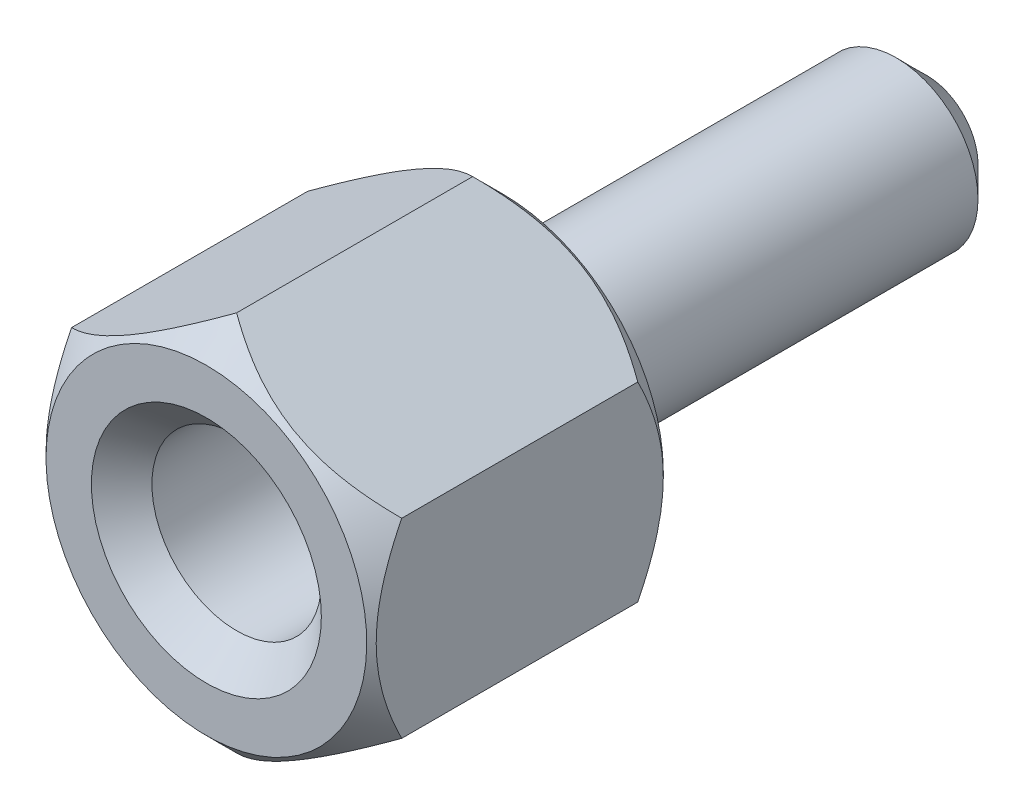
from build123d import *

# Parameters (mm, degrees)
RESSALTO_EXTRUS_O1_DEPTH = 4.9
ESBO_O10_R               = 1.35
RESSALTO_EXTRUS_O2_DEPTH = 7
ESBO_O11_R               = 1.4
CORTE_EXTRUS_O1_DEPTH    = 3.5
CHANFRO1_SIZE            = 0.5
CHANFRO2_SIZE            = 0.5


with BuildPart() as part:
    # Esboço1 → Ressalto-extrusão1 (new body)
    with BuildSketch(Plane.XY):
        Polygon((-2.727980022, 1.575), (-2.727980022, -1.575), (0, -3.15), (2.727980022, -1.575), (2.727980022, 1.575), (0, 3.15), align=None)
    extrude(amount=RESSALTO_EXTRUS_O1_DEPTH)

    # Esboço8 → Corte-Revolução1 (revolve, cut)
    with BuildSketch(Plane(origin=(0, 0, 0), x_dir=(0, 0, -1), z_dir=(1, 0, 0))):
        Polygon((-4.4, 3.15), (-4.9, 2.65), (-4.9, 3.15), align=None)
        Polygon((0, 3.15), (-0.5, 3.15), (0, 2.65), align=None)
    revolve(axis=Axis((0, 0, 0), (0, 0, 1)), mode=Mode.SUBTRACT)

    # Esboço10 → Ressalto-extrusão2 (add)
    with BuildSketch(Plane(origin=(0, 0, 0), x_dir=(-1, 0, 0), z_dir=(0, 0, -1))):
        with Locations(Location((0, 0, 0), (0, 0, 180))):
            Circle(ESBO_O10_R)
    extrude(amount=RESSALTO_EXTRUS_O2_DEPTH)

    # Esboço11 → Corte-extrusão1 (cut)
    with BuildSketch(Plane.XY.offset(4.9)):
        Circle(ESBO_O11_R)
    extrude(amount=-CORTE_EXTRUS_O1_DEPTH, mode=Mode.SUBTRACT)

    # Chanfro1
    chanfro1_edges = [part.edges().sort_by_distance(p)[0] for p in [
        (-1.4, 0, 4.9),
    ]]
    chamfer(chanfro1_edges, length=CHANFRO1_SIZE)

    # Chanfro2
    chanfro2_edges = [part.edges().sort_by_distance(p)[0] for p in [
        (-1.35, 0, -7),
    ]]
    chamfer(chanfro2_edges, length=CHANFRO2_SIZE)


solid = part.part
